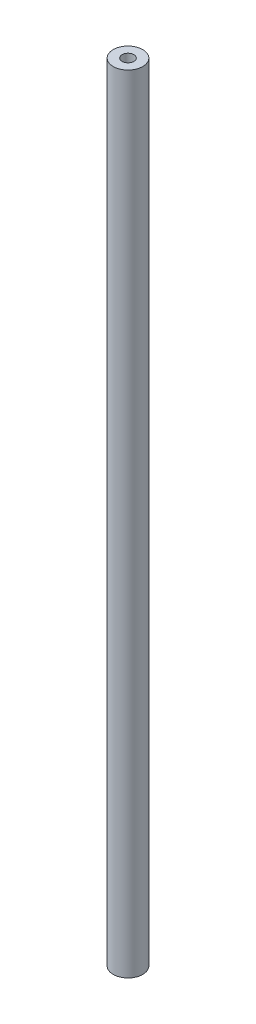
from build123d import *

# Parameters (mm, degrees)
SKETCH_1_R          = 7.5
EXTRUDE_1_DEPTH     = 400
SKETCH_2_R          = 3
CUT_EXTRUDE_1_DEPTH = 20
CUT_EXTRUDE_START   = -20
SKETCH_3_R          = 3
CUT_EXTRUDE_2_DEPTH = 20


with BuildPart() as part:
    # 草图1 → 凸台-拉伸1 (new body)
    with BuildSketch(Plane(origin=(0, 0, 0), x_dir=(1, 0, 0), z_dir=(0, 1, 0))):
        with Locations(Location((0, 0, 0), (0, 0, 270))):
            Circle(SKETCH_1_R)
    extrude(amount=EXTRUDE_1_DEPTH)

    # 草图2 → 切除-拉伸1 (cut)
    with BuildSketch(Plane(origin=(0, 400, 0), x_dir=(1, 0, 0), z_dir=(0, 1, 0))):
        with Locations(Location((0, 0, 0), (0, 0, 270))):
            Circle(SKETCH_2_R)
    extrude(amount=-CUT_EXTRUDE_1_DEPTH, mode=Mode.SUBTRACT)

    # 草图3 → 切除-拉伸2 (cut)
    with BuildSketch(Plane(origin=(0, 0, 0), x_dir=(-1, 0, 0), z_dir=(0, -1, 0)).offset(CUT_EXTRUDE_START)):
        with Locations(Location((0, 0, 0), (0, 0, 270))):
            Circle(SKETCH_3_R)
    extrude(amount=CUT_EXTRUDE_2_DEPTH, mode=Mode.SUBTRACT)


solid = part.part
